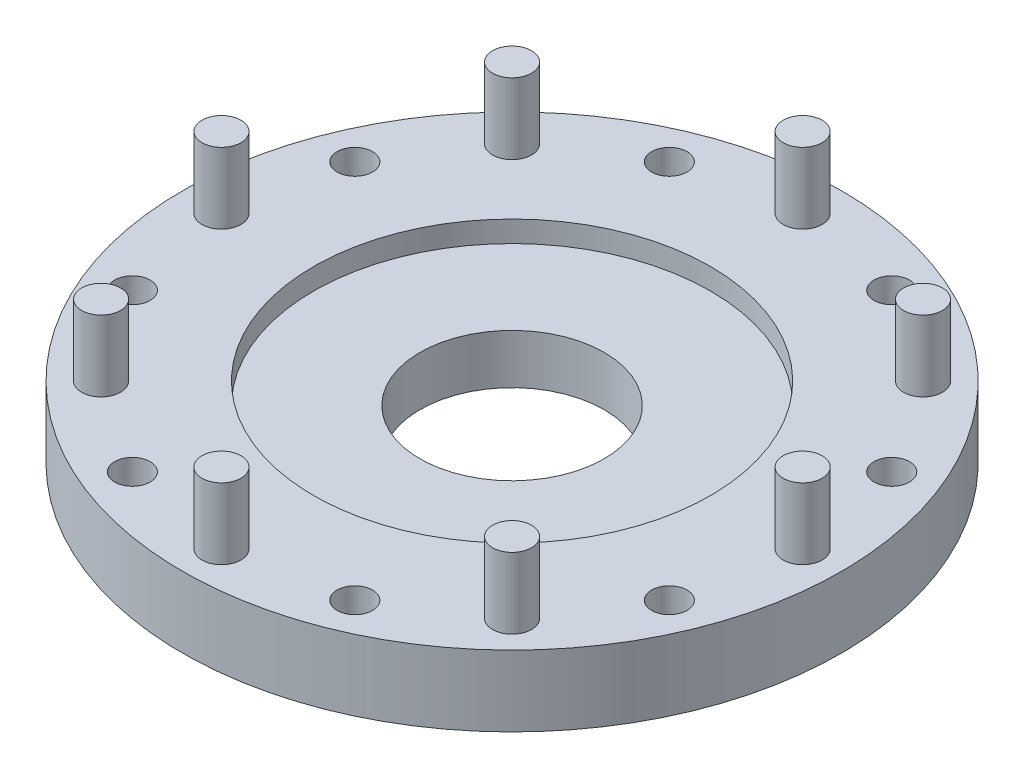
from build123d import *

# Parameters (mm, degrees)
CUT_EXTRUDE1_DEPTH      = 67.516915142
CUT_EXTRUDE1_DEPTH_BACK = 67.516915142
SKETCH2_R               = 2.75
SKETCH2_R_2             = 2.5
SKETCH3_W               = 5
SKETCH3_H               = 4
CUT_EXTRUDE2_DEPTH      = 5
BOSS_EXTRUDE1_START     = -20
SKETCH5_R               = 2.75
BOSS_EXTRUDE1_DEPTH     = 20


with BuildPart() as part:
    # Sketch1 → Revolve1 (revolve)
    with BuildSketch(Plane.XY, mode=Mode.PRIVATE) as revolve1_sk:
        Polygon((-28, 10), (-46.5, 10), (-46.5, 0), (-13, 0), (-13, 7), (-28, 7), align=None)
    revolve(revolve1_sk.sketch.rotate(Axis((0, -1.751877994, 0), (0, 1, 0)), 270), axis=Axis((0, -1.751877994, 0), (0, 1, 0)))

    # Sketch2 → Cut-Extrude1 (cut, two sides: drawn at the far end of the back side and taken through both)
    with BuildSketch(Plane(origin=(0, 10, 0), x_dir=(1, 0, 0), z_dir=(0, 1, 0)).offset(-CUT_EXTRUDE1_DEPTH_BACK)):
        with Locations(Location((0, 41, 0), (0, 0, 270))):
            Circle(SKETCH2_R)
        with Locations(Location((15.690020727, 37.879060833, 0), (0, 0, 270))):
            Circle(SKETCH2_R_2)
        with Locations(Location((28.991378029, 28.991378029, 0), (0, 0, 270))):
            Circle(SKETCH2_R)
        with Locations(Location((37.879060833, 15.690020727, 0), (0, 0, 270))):
            Circle(SKETCH2_R_2)
        with Locations(Location((41, 0, 0), (0, 0, 270))):
            Circle(SKETCH2_R)
        with Locations(Location((37.879060833, -15.690020727, 0), (0, 0, 270))):
            Circle(SKETCH2_R_2)
        with Locations(Location((28.991378029, -28.991378029, 0), (0, 0, 270))):
            Circle(SKETCH2_R)
        with Locations(Location((15.690020727, -37.879060833, 0), (0, 0, 270))):
            Circle(SKETCH2_R_2)
        with Locations(Location((0, -41, 0), (0, 0, 270))):
            Circle(SKETCH2_R)
        with Locations(Location((-15.690020727, -37.879060833, 0), (0, 0, 270))):
            Circle(SKETCH2_R_2)
        with Locations(Location((-28.991378029, -28.991378029, 0), (0, 0, 270))):
            Circle(SKETCH2_R)
        with Locations(Location((-37.879060833, -15.690020727, 0), (0, 0, 270))):
            Circle(SKETCH2_R_2)
        with Locations(Location((-41, 0, 0), (0, 0, 270))):
            Circle(SKETCH2_R)
        with Locations(Location((-37.879060833, 15.690020727, 0), (0, 0, 270))):
            Circle(SKETCH2_R_2)
        with Locations(Location((-28.991378029, 28.991378029, 0), (0, 0, 270))):
            Circle(SKETCH2_R)
        with Locations(Location((-15.690020727, 37.879060833, 0), (0, 0, 270))):
            Circle(SKETCH2_R_2)
    extrude(amount=CUT_EXTRUDE1_DEPTH + CUT_EXTRUDE1_DEPTH_BACK, mode=Mode.SUBTRACT)

    # Sketch3 → Cut-Revolve1 (revolve, cut)
    with BuildSketch(Plane.XY, mode=Mode.PRIVATE) as cut_revolve1_sk:
        with Locations((25, 2)):
            Rectangle(SKETCH3_W, SKETCH3_H)
    revolve(cut_revolve1_sk.sketch.rotate(Axis((0, -19.065406541, 0), (0, 1, 0)), 90), axis=Axis((0, -19.065406541, 0), (0, 1, 0)), mode=Mode.SUBTRACT)

    # Sketch4 → Cut-Extrude2 (cut)
    with BuildSketch(Plane.XZ):
        Polygon((-19.154122342, 39.879060833), (-19.154122342, 35.879060833), (-15.690020727, 33.879060833), (-12.225919112, 35.879060833), (-12.225919112, 39.879060833), (-15.690020727, 41.879060833), align=None)
        Polygon((18.518447852, 40.707487958), (14.654744547, 41.742764138), (11.826317422, 38.914337013), (12.861593602, 35.050633708), (16.725296907, 34.015357528), (19.553724032, 36.843784653), align=None)
        Polygon((41.879060833, 15.690020727), (39.879060833, 19.154122342), (35.879060833, 19.154122342), (33.879060833, 15.690020727), (35.879060833, 12.225919112), (39.879060833, 12.225919112), align=None)
        Polygon((40.707487958, -18.518447852), (41.742764138, -14.654744547), (38.914337013, -11.826317422), (35.050633708, -12.861593602), (34.015357528, -16.725296907), (36.843784653, -19.553724032), align=None)
        Polygon((15.690020727, -41.879060833), (19.154122342, -39.879060833), (19.154122342, -35.879060833), (15.690020727, -33.879060833), (12.225919112, -35.879060833), (12.225919112, -39.879060833), align=None)
        Polygon((-18.518447852, -40.707487958), (-14.654744547, -41.742764138), (-11.826317422, -38.914337013), (-12.861593602, -35.050633708), (-16.725296907, -34.015357528), (-19.553724032, -36.843784653), align=None)
        Polygon((-41.879060833, -15.690020727), (-39.879060833, -19.154122342), (-35.879060833, -19.154122342), (-33.879060833, -15.690020727), (-35.879060833, -12.225919112), (-39.879060833, -12.225919112), align=None)
        Polygon((-40.707487958, 18.518447852), (-41.742764138, 14.654744547), (-38.914337013, 11.826317422), (-35.050633708, 12.861593602), (-34.015357528, 16.725296907), (-36.843784653, 19.553724032), align=None)
    extrude(amount=-CUT_EXTRUDE2_DEPTH, mode=Mode.SUBTRACT)

    # Sketch5 → Boss-Extrude1 (add)
    with BuildSketch(Plane.XZ.offset(BOSS_EXTRUDE1_START)):
        with Locations(Location((0, 41, 0), (0, 0, 270))):
            Circle(SKETCH5_R)
        with Locations(Location((28.991378029, 28.991378029, 0), (0, 0, 270))):
            Circle(SKETCH5_R)
        with Locations(Location((41, 0, 0), (0, 0, 270))):
            Circle(SKETCH5_R)
        with Locations(Location((28.991378029, -28.991378029, 0), (0, 0, 270))):
            Circle(SKETCH5_R)
        with Locations(Location((0, -41, 0), (0, 0, 270))):
            Circle(SKETCH5_R)
        with Locations(Location((-28.991378029, -28.991378029, 0), (0, 0, 270))):
            Circle(SKETCH5_R)
        with Locations(Location((-41, 0, 0), (0, 0, 270))):
            Circle(SKETCH5_R)
        with Locations(Location((-28.991378029, 28.991378029, 0), (0, 0, 270))):
            Circle(SKETCH5_R)
    extrude(amount=BOSS_EXTRUDE1_DEPTH)


solid = part.part
